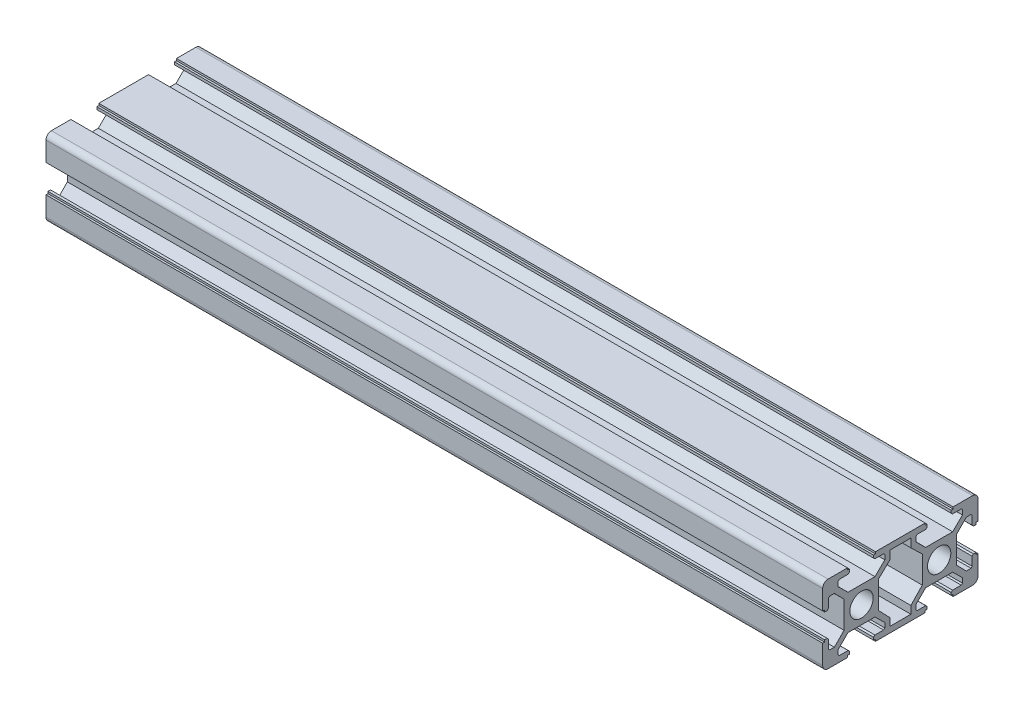
from build123d import *

# Parameters (mm, degrees)
SKETCH_1_R      = 3
EXTRUDE_1_DEPTH = 200


with BuildPart() as part:
    # Эскиз1 → Бобышка-Вытянуть1 (new body)
    with BuildSketch(Plane(origin=(0, 0, 0), x_dir=(0, 0, -1), z_dir=(1, 0, 0))):
        with BuildLine():
            Line((19.519439061, 34.299030696), (24.519439061, 34.299030696))
            Line((24.519439061, 34.299030696), (27.319439061, 34.299030696))
            Line((27.319439061, 34.299030696), (32.319439061, 34.299030696))
            Line((32.319439061, 34.299030696), (32.319439061, 33.799030696))
            Line((32.319439061, 33.799030696), (32.819439061, 33.799030696))
            Line((32.819439061, 33.799030696), (32.819439061, 33.123453071))
            Line((32.819439061, 33.123453071), (32.470086687, 32.799030696))
            Line((32.470086687, 32.799030696), (30.231003523, 32.799030696))
            Line((30.231003523, 32.799030696), (29.919439061, 32.509699663))
            Line((29.919439061, 32.509699663), (29.919439061, 31.288014106))
            Line((29.919439061, 31.288014106), (32.444289636, 28.799030696))
            Line((32.444289636, 28.799030696), (39.394588486, 28.799030696))
            Line((39.394588486, 28.799030696), (41.919439061, 31.288014106))
            Line((41.919439061, 31.288014106), (41.919439061, 32.509699663))
            Line((41.919439061, 32.509699663), (41.607874598, 32.799030696))
            Line((41.607874598, 32.799030696), (39.368791434, 32.799030696))
            Line((39.368791434, 32.799030696), (39.019439061, 33.123453071))
            Line((39.019439061, 33.123453071), (39.019439061, 33.799030696))
            Line((39.019439061, 33.799030696), (39.519439061, 33.799030696))
            Line((39.519439061, 33.799030696), (39.519439061, 34.299030696))
            Line((39.519439061, 34.299030696), (44.519439061, 34.299030696))
            ThreePointArc((44.519439061, 34.299030696), (45.509388554, 33.88898019), (45.919439061, 32.899030696))
            Line((45.919439061, 32.899030696), (45.919439061, 27.899030696))
            Line((45.919439061, 27.899030696), (45.419439061, 27.899030696))
            Line((45.419439061, 27.899030696), (45.419439061, 27.399030696))
            Line((45.419439061, 27.399030696), (44.743861436, 27.399030696))
            Line((44.743861436, 27.399030696), (44.419439061, 27.748383069))
            Line((44.419439061, 27.748383069), (44.419439061, 29.987466234))
            Line((44.419439061, 29.987466234), (44.130108028, 30.299030696))
            Line((44.130108028, 30.299030696), (42.908422471, 30.299030696))
            Line((42.908422471, 30.299030696), (40.419439061, 27.774180121))
            Line((40.419439061, 27.774180121), (40.419439061, 20.823881271))
            Line((40.419439061, 20.823881271), (42.908422471, 18.299030696))
            Line((42.908422471, 18.299030696), (44.130108028, 18.299030696))
            Line((44.130108028, 18.299030696), (44.419439061, 18.610595158))
            Line((44.419439061, 18.610595158), (44.419439061, 20.849678323))
            Line((44.419439061, 20.849678323), (44.743861436, 21.199030696))
            Line((44.743861436, 21.199030696), (45.419439061, 21.199030696))
            Line((45.419439061, 21.199030696), (45.419439061, 20.699030696))
            Line((45.419439061, 20.699030696), (45.919439061, 20.699030696))
            Line((45.919439061, 20.699030696), (45.919439061, 15.699030696))
            ThreePointArc((45.919439061, 15.699030696), (45.509388554, 14.709081202), (44.519439061, 14.299030696))
            Line((44.519439061, 14.299030696), (39.519439061, 14.299030696))
            Line((39.519439061, 14.299030696), (39.519439061, 14.799030696))
            Line((39.519439061, 14.799030696), (39.019439061, 14.799030696))
            Line((39.019439061, 14.799030696), (39.019439061, 15.47460832))
            Line((39.019439061, 15.47460832), (39.368791434, 15.799030696))
            Line((39.368791434, 15.799030696), (41.607874598, 15.799030696))
            Line((41.607874598, 15.799030696), (41.919439061, 16.088361729))
            Line((41.919439061, 16.088361729), (41.919439061, 17.310047285))
            Line((41.919439061, 17.310047285), (39.394588486, 19.799030696))
            Line((39.394588486, 19.799030696), (32.444289636, 19.799030696))
            Line((32.444289636, 19.799030696), (29.919439061, 17.310047285))
            Line((29.919439061, 17.310047285), (29.919439061, 16.088361729))
            Line((29.919439061, 16.088361729), (30.231003523, 15.799030696))
            Line((30.231003523, 15.799030696), (32.470086687, 15.799030696))
            Line((32.470086687, 15.799030696), (32.819439061, 15.47460832))
            Line((32.819439061, 15.47460832), (32.819439061, 14.799030696))
            Line((32.819439061, 14.799030696), (32.319439061, 14.799030696))
            Line((32.319439061, 14.799030696), (32.319439061, 14.299030696))
            Line((32.319439061, 14.299030696), (27.319439061, 14.299030696))
            Line((27.319439061, 14.299030696), (24.519439061, 14.299030696))
            Line((24.519439061, 14.299030696), (19.519439061, 14.299030696))
            Line((19.519439061, 14.299030696), (19.519439061, 14.799030696))
            Line((19.519439061, 14.799030696), (19.019439061, 14.799030696))
            Line((19.019439061, 14.799030696), (19.019439061, 15.47460832))
            Line((19.019439061, 15.47460832), (19.368791434, 15.799030696))
            Line((19.368791434, 15.799030696), (21.607874598, 15.799030696))
            Line((21.607874598, 15.799030696), (21.919439061, 16.088361729))
            Line((21.919439061, 16.088361729), (21.919439061, 17.310047285))
            Line((21.919439061, 17.310047285), (19.394588486, 19.799030696))
            Line((19.394588486, 19.799030696), (12.444289636, 19.799030696))
            Line((12.444289636, 19.799030696), (9.919439061, 17.310047285))
            Line((9.919439061, 17.310047285), (9.919439061, 16.088361729))
            Line((9.919439061, 16.088361729), (10.231003523, 15.799030696))
            Line((10.231003523, 15.799030696), (12.470086687, 15.799030696))
            Line((12.470086687, 15.799030696), (12.819439061, 15.47460832))
            Line((12.819439061, 15.47460832), (12.819439061, 14.799030696))
            Line((12.819439061, 14.799030696), (12.319439061, 14.799030696))
            Line((12.319439061, 14.799030696), (12.319439061, 14.299030696))
            Line((12.319439061, 14.299030696), (7.319439061, 14.299030696))
            ThreePointArc((7.319439061, 14.299030696), (6.329489567, 14.709081202), (5.919439061, 15.699030696))
            Line((5.919439061, 15.699030696), (5.919439061, 20.699030696))
            Line((5.919439061, 20.699030696), (6.419439061, 20.699030696))
            Line((6.419439061, 20.699030696), (6.419439061, 21.199030696))
            Line((6.419439061, 21.199030696), (7.095016685, 21.199030696))
            Line((7.095016685, 21.199030696), (7.419439061, 20.849678323))
            Line((7.419439061, 20.849678323), (7.419439061, 18.610595158))
            Line((7.419439061, 18.610595158), (7.708770093, 18.299030696))
            Line((7.708770093, 18.299030696), (8.93045565, 18.299030696))
            Line((8.93045565, 18.299030696), (11.419439061, 20.823881271))
            Line((11.419439061, 20.823881271), (11.419439061, 27.774180121))
            Line((11.419439061, 27.774180121), (8.93045565, 30.299030696))
            Line((8.93045565, 30.299030696), (7.708770093, 30.299030696))
            Line((7.708770093, 30.299030696), (7.419439061, 29.987466234))
            Line((7.419439061, 29.987466234), (7.419439061, 27.748383069))
            Line((7.419439061, 27.748383069), (7.095016685, 27.399030696))
            Line((7.095016685, 27.399030696), (6.419439061, 27.399030696))
            Line((6.419439061, 27.399030696), (6.419439061, 27.899030696))
            Line((6.419439061, 27.899030696), (5.919439061, 27.899030696))
            Line((5.919439061, 27.899030696), (5.919439061, 32.899030696))
            ThreePointArc((5.919439061, 32.899030696), (6.329489567, 33.88898019), (7.319439061, 34.299030696))
            Line((7.319439061, 34.299030696), (12.319439061, 34.299030696))
            Line((12.319439061, 34.299030696), (12.319439061, 33.799030696))
            Line((12.319439061, 33.799030696), (12.819439061, 33.799030696))
            Line((12.819439061, 33.799030696), (12.819439061, 33.123453071))
            Line((12.819439061, 33.123453071), (12.470086687, 32.799030696))
            Line((12.470086687, 32.799030696), (10.231003523, 32.799030696))
            Line((10.231003523, 32.799030696), (9.919439061, 32.509699663))
            Line((9.919439061, 32.509699663), (9.919439061, 31.288014106))
            Line((9.919439061, 31.288014106), (12.444289636, 28.799030696))
            Line((12.444289636, 28.799030696), (19.394588486, 28.799030696))
            Line((19.394588486, 28.799030696), (21.919439061, 31.288014106))
            Line((21.919439061, 31.288014106), (21.919439061, 32.509699663))
            Line((21.919439061, 32.509699663), (21.607874598, 32.799030696))
            Line((21.607874598, 32.799030696), (19.368791434, 32.799030696))
            Line((19.368791434, 32.799030696), (19.019439061, 33.123453071))
            Line((19.019439061, 33.123453071), (19.019439061, 33.799030696))
            Line((19.019439061, 33.799030696), (19.519439061, 33.799030696))
            Line((19.519439061, 33.799030696), (19.519439061, 34.299030696))
        make_face()
        with Locations((15.919439061, 24.299030696)):
            Circle(SKETCH_1_R, mode=Mode.SUBTRACT)
        with Locations((35.919439061, 24.299030696)):
            Circle(SKETCH_1_R, mode=Mode.SUBTRACT)
        Polygon((28.627102151, 32.799030696), (23.21177597, 32.799030696), (23.21177597, 30.602545824), (20.272319384, 27.774180121), (20.272319384, 20.823881271), (23.21177597, 17.768970439), (23.21177597, 15.799030696), (28.627102151, 15.799030696), (28.627102151, 17.768970439), (31.566558738, 20.823881271), (31.566558738, 27.774180121), (28.627102151, 30.602545824), align=None, mode=Mode.SUBTRACT)
    extrude(amount=EXTRUDE_1_DEPTH)


solid = part.part
